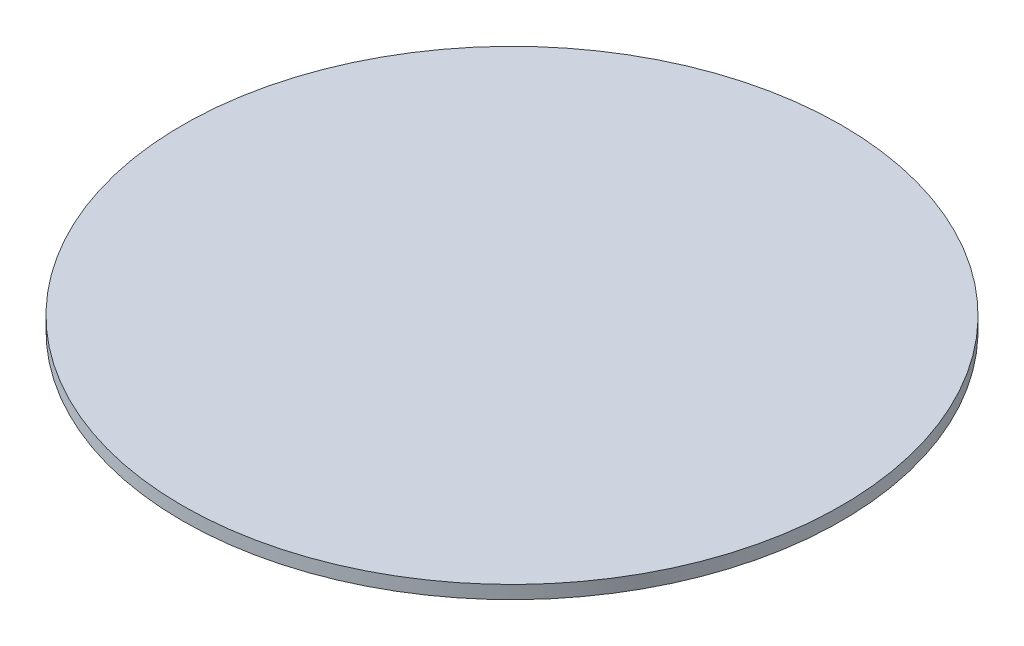
from build123d import *

# Parameters (mm, degrees)
SKETCH1_R           = 25
BOSS_EXTRUDE1_DEPTH = 1


with BuildPart() as part:
    # Sketch1 → Boss-Extrude1 (new body)
    with BuildSketch(Plane(origin=(0, 0, 0), x_dir=(1, 0, 0), z_dir=(0, 1, 0))):
        with Locations(Location((0, 0, 0), (0, 0, 270))):
            Circle(SKETCH1_R)
    extrude(amount=BOSS_EXTRUDE1_DEPTH)


solid = part.part
